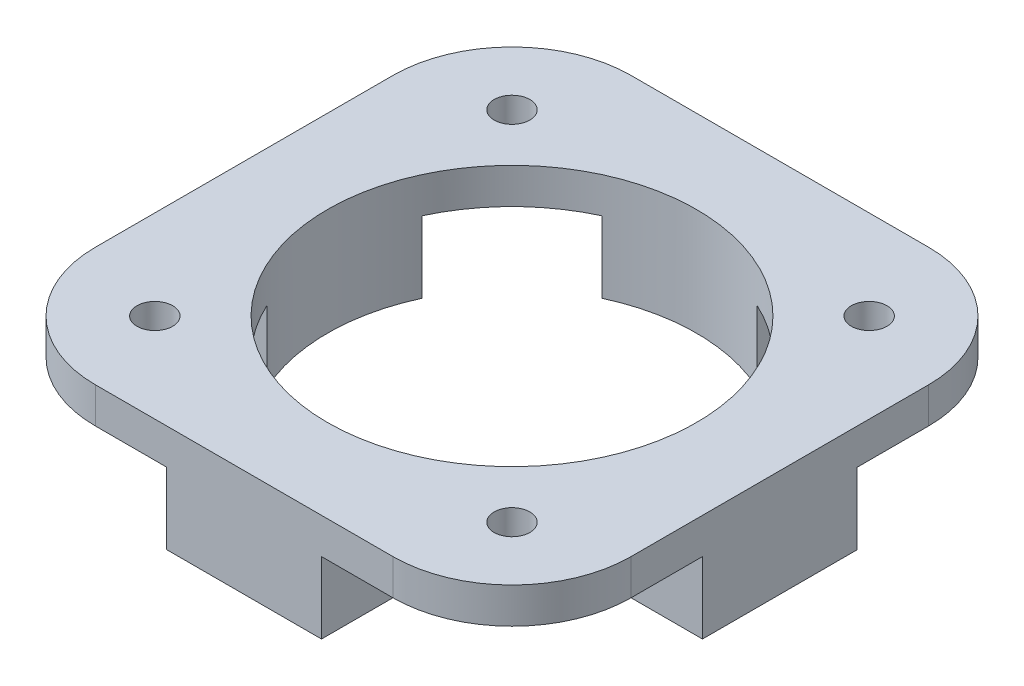
from build123d import *

# Parameters (mm, degrees)
SKETCH1_R           = 1.5
BOSS_EXTRUDE1_DEPTH = 3
BOSS_EXTRUDE2_DEPTH = 6
SKETCH3_R           = 15.5
CUT_EXTRUDE1_DEPTH  = 7.5


with BuildPart() as part:
    # Sketch1 → Boss-Extrude1 (new body)
    with BuildSketch(Plane(origin=(0, 0, 0), x_dir=(1, 0, 0), z_dir=(0, 1, 0))):
        with BuildLine():
            Line((12.998335315, -22.998335315), (-12.001664685, -22.998335315))
            ThreePointArc((-12.001664685, -22.998335315), (-19.072732497, -20.069403127), (-22.001664685, -12.998335315))
            Line((-22.001664685, -12.998335315), (-22.001664685, 12.001664685))
            ThreePointArc((-22.001664685, 12.001664685), (-19.072732497, 19.072732497), (-12.001664685, 22.001664685))
            Line((-12.001664685, 22.001664685), (12.998335315, 22.001664685))
            ThreePointArc((12.998335315, 22.001664685), (20.069403127, 19.072732497), (22.998335315, 12.001664685))
            Line((22.998335315, 12.001664685), (22.998335315, -12.998335315))
            ThreePointArc((22.998335315, -12.998335315), (20.069403127, -20.069403127), (12.998335315, -22.998335315))
        make_face()
        with Locations(Location((-14.501664685, 14.501664685, 0), (0, 0, 270))):
            Circle(SKETCH1_R, mode=Mode.SUBTRACT)
        with Locations(Location((15.498335315, 14.501664685, 0), (0, 0, 90))):
            Circle(SKETCH1_R, mode=Mode.SUBTRACT)
        with Locations(Location((15.498335315, -15.498335315, 0), (0, 0, 270))):
            Circle(SKETCH1_R, mode=Mode.SUBTRACT)
        with Locations(Location((-14.501664685, -15.498335315, 0), (0, 0, 90))):
            Circle(SKETCH1_R, mode=Mode.SUBTRACT)
    extrude(amount=BOSS_EXTRUDE1_DEPTH)

    # Sketch2 → Boss-Extrude2 (add)
    with BuildSketch(Plane(origin=(0, 0, 0), x_dir=(1, 0, 0), z_dir=(0, 1, 0))):
        Polygon((-6, 22.001664685), (-6, 6), (-22.001664685, 6), (-22.001664685, -6.998335315), (-6.001664685, -6.998335315), (-6.001664685, -22.998335315), (6.998335315, -22.998335315), (6.998335315, -6.998335315), (22.998335315, -6.998335315), (22.998335315, 6), (6.998335315, 6), (6.998335315, 22.001664685), align=None)
    extrude(amount=-BOSS_EXTRUDE2_DEPTH)

    # Sketch3 → Cut-Extrude1 (cut, symmetric)
    with BuildSketch(Plane(origin=(0, 0, 0), x_dir=(1, 0, 0), z_dir=(0, 1, 0))):
        with Locations(Location((0.498335315, -0.498335315, 0), (0, 0, 114.787084328))):
            Circle(SKETCH3_R)
    extrude(amount=CUT_EXTRUDE1_DEPTH, both=True, mode=Mode.SUBTRACT)


solid = part.part
